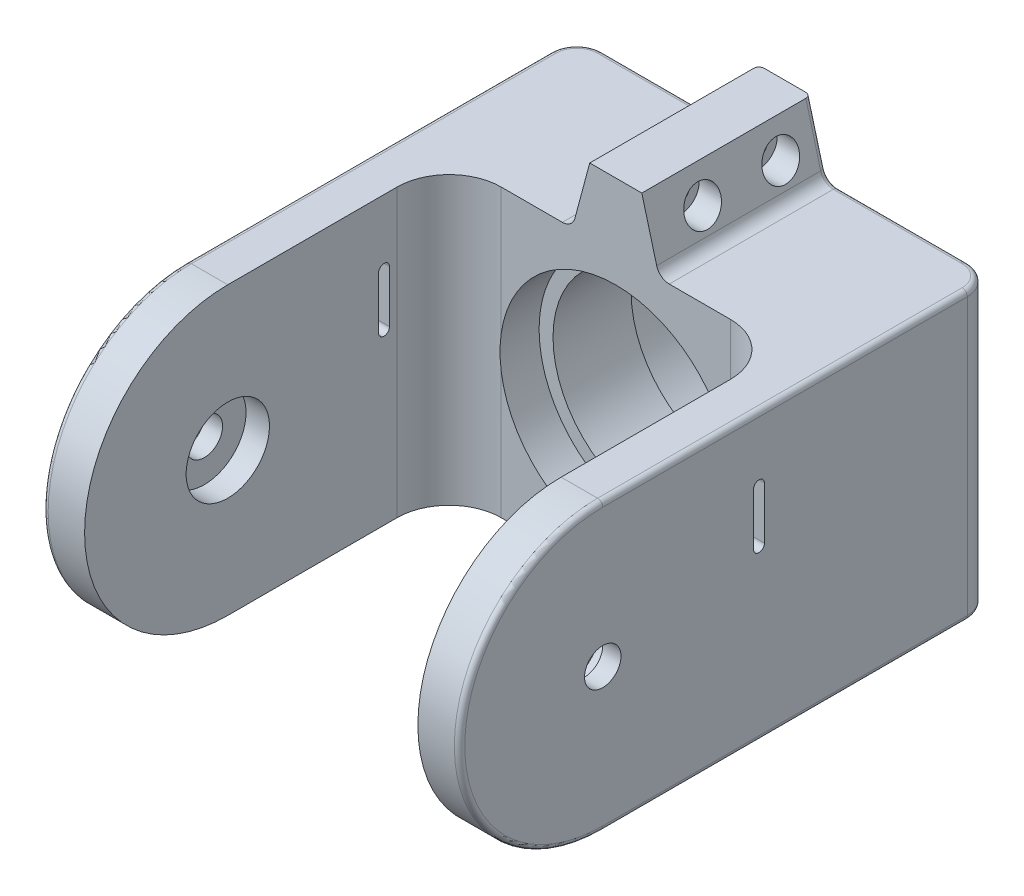
from build123d import *

# Parameters (mm, degrees)
SKETCH1_R                 = 44.45
SKETCH1_R_2               = 39.1
CENTRE_HOLE_FOR_L2_DEPTH  = 30
MAIN_STRUCTURE_DEPTH      = 100
MAIN_STRUCTURE_DEPTH_BACK = 50
SKETCH2_W                 = 160
SKETCH2_H                 = 110
SKETCH2_R                 = 44.45
BEARING_CURVE_DEPTH       = 16
SKETCH6_R                 = 7
SHAFT_HOLE_DEPTH          = 16
WRIST_CUTOUT_DEPTH        = 230.619250064
SKETCH9_R                 = 16
BEARING_DEPTH             = 9
FILLET2_R                 = 10
BOLT_STRUCTURE_DEPTH      = 65
SKETCH11_R                = 3.1
CUT_EXTRUDE6_DEPTH        = 217.852484422
CUT_EXTRUDE8_REACH        = 223.852
CUT_EXTRUDE8_START        = 5
SKETCH13_R                = 7
FILLET3_R                 = 5
FILLET1_R                 = 2
TENSIONER_SLOT_DEPTH      = 144


with BuildPart() as part:
    # Sketch1 → Centre Hole for L2 (new body)
    with BuildSketch(Plane.XY):
        Circle(SKETCH1_R)
        Circle(SKETCH1_R_2, mode=Mode.SUBTRACT)
    extrude(amount=CENTRE_HOLE_FOR_L2_DEPTH)


with BuildPart() as body_2:
    # Sketch2 → Main Structure (new, two sides: drawn at the far end of the back side and taken through both)
    with BuildSketch(Plane.XY.offset(30).offset(-MAIN_STRUCTURE_DEPTH_BACK)):
        Rectangle(SKETCH2_W, SKETCH2_H)
        Circle(SKETCH2_R, mode=Mode.SUBTRACT)
    extrude(amount=MAIN_STRUCTURE_DEPTH + MAIN_STRUCTURE_DEPTH_BACK)

    # Sketch3 → Bearing Curve (add)
    with BuildSketch(Plane.ZY.offset(80)):
        with BuildLine():
            Line((130, 55), (130, -55))
            ThreePointArc((130, -55), (185, 0), (130, 55))
        make_face()
    bearing_curve = extrude(amount=-BEARING_CURVE_DEPTH)

    # Upright Mirror: Bearing Curve across plane
    add(bearing_curve.mirror(Plane(origin=(0, 0, 0), x_dir=(0, 0, 1), z_dir=(1, 0, 0))))

    # Sketch6 → Shaft Hole (cut)
    with BuildSketch(Plane.ZY.offset(80)):
        with Locations((130, 0)):
            Circle(SKETCH6_R)
    shaft_hole = extrude(amount=-SHAFT_HOLE_DEPTH, mode=Mode.SUBTRACT)

    # Sketch4 → Wrist Cutout (cut, through all)
    with BuildSketch(Plane(origin=(0, 55, 0), x_dir=(1, 0, 0), z_dir=(0, 1, 0))):
        with BuildLine():
            Line((-64, -130), (-64, -65))
            ThreePointArc((-64, -65), (-58.142135624, -50.857864376), (-44, -45))
            Line((-44, -45), (44, -45))
            ThreePointArc((44, -45), (58.142135624, -50.857864376), (64, -65))
            Line((64, -65), (64, -130))
            Line((64, -130), (-64, -130))
        make_face()
    extrude(amount=-WRIST_CUTOUT_DEPTH, mode=Mode.SUBTRACT)

    # Sketch9 → Bearing (cut)
    with BuildSketch(Plane(origin=(-64, 0, 0), x_dir=(0, 0, -1), z_dir=(1, 0, 0))):
        with Locations((-130, 0)):
            Circle(SKETCH9_R)
    bearing = extrude(amount=-BEARING_DEPTH, mode=Mode.SUBTRACT)

    # Bearing Mirror: Shaft Hole, Bearing across plane
    add(shaft_hole.mirror(Plane(origin=(0, 0, 0), x_dir=(0, 0, 1), z_dir=(1, 0, 0))), mode=Mode.SUBTRACT)
    add(bearing.mirror(Plane(origin=(0, 0, 0), x_dir=(0, 0, 1), z_dir=(1, 0, 0))), mode=Mode.SUBTRACT)

    # Fillet2
    fillet2_edges = [body_2.edges().sort_by_distance(p)[0] for p in [
        (-80, 0, -20),
        (80, 0, -20),
    ]]
    fillet(fillet2_edges, radius=FILLET2_R)

    # Sketch10 → Bolt Structure (add)
    with BuildSketch(Plane(origin=(0, 0, -20), x_dir=(-1, 0, 0), z_dir=(0, 0, -1))):
        Polygon((10, 80), (-10, 80), (-16.698729811, 55), (16.698729811, 55), align=None)
    bolt_structure = extrude(amount=-BOLT_STRUCTURE_DEPTH)

    # Sketch11 → Cut-Extrude6 (cut, symmetric)
    with BuildSketch(Plane(origin=(0, 0, 0), x_dir=(0, 0, -1), z_dir=(1, 0, 0))):
        with Locations(Location((5, 67.5, 0), (0, 0, 90))):
            Circle(SKETCH11_R)
        with Locations(Location((-25, 67.5, 0), (0, 0, 90))):
            Circle(SKETCH11_R)
    cut_extrude6 = extrude(amount=CUT_EXTRUDE6_DEPTH, both=True, mode=Mode.SUBTRACT)

    # Cut-Extrude8: up to this plane
    cut_extrude8_end = Plane(origin=(10, 80, 86.71798544), z_dir=(0.9659258262890692, 0.2588190451025176, 0))
    # Sketch13 → Cut-Extrude8 (cut, up to the surface)
    with BuildSketch(Plane(origin=(0, 0, 0), x_dir=(0, 0, -1), z_dir=(1, 0, 0)).offset(CUT_EXTRUDE8_START), mode=Mode.PRIVATE) as cut_extrude8_sk1:
        with Locations(Location((5, 67.5, 0), (0, 0, 90))):
            Circle(SKETCH13_R)
    cut_extrude8_tool1 = split(extrude(cut_extrude8_sk1.sketch, amount=CUT_EXTRUDE8_REACH, mode=Mode.PRIVATE), bisect_by=cut_extrude8_end, keep=Keep.BOTH, mode=Mode.PRIVATE)
    # Sketch13 → Cut-Extrude8 (cut, up to the surface)
    with BuildSketch(Plane(origin=(0, 0, 0), x_dir=(0, 0, -1), z_dir=(1, 0, 0)).offset(CUT_EXTRUDE8_START), mode=Mode.PRIVATE) as cut_extrude8_sk2:
        with Locations(Location((-25, 67.5, 0), (0, 0, 90))):
            Circle(SKETCH13_R)
    cut_extrude8_tool2 = split(extrude(cut_extrude8_sk2.sketch, amount=CUT_EXTRUDE8_REACH, mode=Mode.PRIVATE), bisect_by=cut_extrude8_end, keep=Keep.BOTH, mode=Mode.PRIVATE)
    cut_extrude8 = cut_extrude8_tool1.solids().sort_by_distance((5, 67.5, -5))[0] + cut_extrude8_tool2.solids().sort_by_distance((5, 67.5, 25))[0]
    add(cut_extrude8, mode=Mode.SUBTRACT)

    # Mirror8: Bolt Structure, Cut-Extrude6, Cut-Extrude8 across plane
    add(bolt_structure.mirror(Plane.ZX))
    add(cut_extrude6.mirror(Plane.ZX), mode=Mode.SUBTRACT)
    add(cut_extrude8.mirror(Plane.ZX), mode=Mode.SUBTRACT)

    # Fillet3
    fillet3_edges = [body_2.edges().sort_by_distance(p)[0] for p in [
        (-16.698729811, 55, 12.5),
        (16.698729811, 55, 12.5),
        (16.698729811, -55, 12.5),
        (-16.698729811, -55, 12.5),
    ]]
    fillet(fillet3_edges, radius=FILLET3_R)

    # Fillet1
    fillet1_edges = [body_2.edges().sort_by_distance(p)[0] for p in [
        (-45.267682375, -55, -20),
        (80, -55, 60),
        (77.071067812, -55, -17.071067812),
        (-77.071067812, -55, -17.071067812),
        (-45.267682375, 55, -20),
        (80, 55, 60),
        (77.071067812, 55, -17.071067812),
        (-77.071067812, 55, -17.071067812),
        (12.85286781, 69.352952387, -20),
        (12.85286781, -69.352952387, -20),
        (-12.85286781, -69.352952387, -20),
        (45.267682375, -55, -20),
        (-12.85286781, 69.352952387, -20),
        (45.267682375, 55, -20),
        (-17.491557606, -56.033233299, -20),
        (17.491557606, -56.033233299, -20),
        (-17.491557606, 56.033233299, -20),
        (17.491557606, 56.033233299, -20),
        (-80, 0, 185),
        (80, 0, 185),
        (-80, -55, 60),
        (-80, 55, 60),
    ]]
    fillet(fillet1_edges, radius=FILLET1_R)

    # Sketch14 → Tensioner Slot (cut)
    with BuildSketch(Plane.ZY.offset(80)):
        with BuildLine():
            Line((72.1, 30), (72.1, 10))
            ThreePointArc((72.1, 10), (70, 7.9), (67.9, 10))
            Line((67.9, 10), (67.9, 30))
            ThreePointArc((67.9, 30), (70, 32.1), (72.1, 30))
        make_face()
    tensioner_slot = extrude(amount=-TENSIONER_SLOT_DEPTH, mode=Mode.SUBTRACT)

    # Mirror9: Tensioner Slot across plane
    add(tensioner_slot.mirror(Plane(origin=(0, 0, 0), x_dir=(0, 0, 1), z_dir=(1, 0, 0))), mode=Mode.SUBTRACT)


solid = Compound([part.part, body_2.part])
